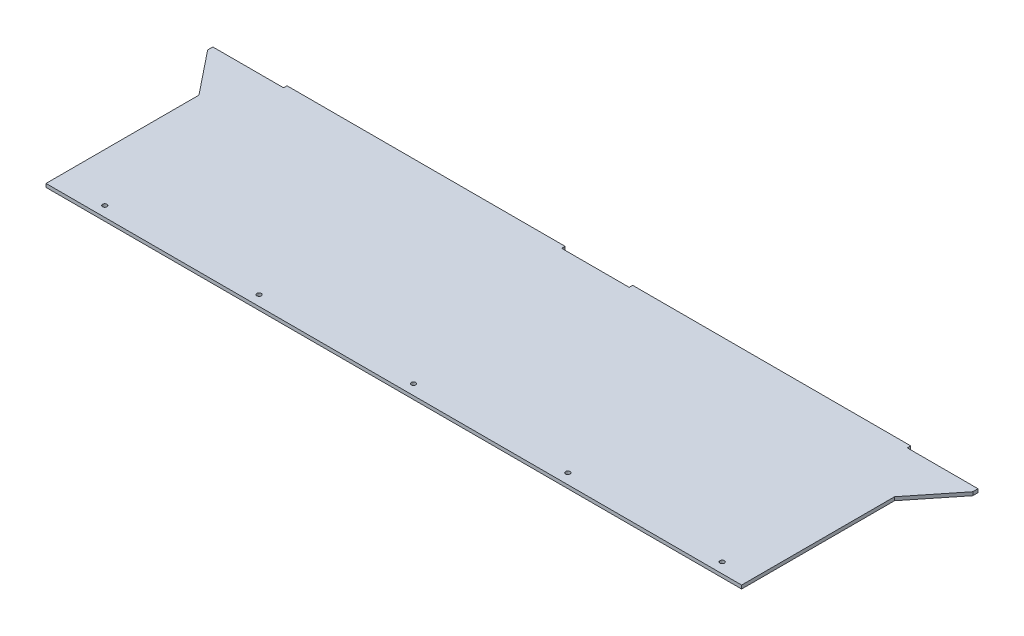
from build123d import *

# Parameters (mm, degrees)
SKETCH1_W           = 635.3556
SKETCH1_H           = 184.15
BOSS_EXTRUDE1_DEPTH = 1.5875
SKETCH2_W           = 254
SKETCH2_H           = 3.175
BOSS_EXTRUDE2_DEPTH = 3.175
BOSS_EXTRUDE3_DEPTH = 3.175
CUT_EXTRUDE1_DEPTH  = 10
LPATTERN1_COUNT     = 5
LPATTERN1_PITCH     = 140.97


with BuildPart() as part:
    # Sketch1 → Boss-Extrude1 (new, symmetric)
    with BuildSketch(Plane(origin=(0, 0, 0), x_dir=(1, 0, 0), z_dir=(0, 1, 0))):
        Rectangle(SKETCH1_W, SKETCH1_H)
    extrude(amount=BOSS_EXTRUDE1_DEPTH, both=True)

    # Sketch2 → Boss-Extrude2 (add)
    with BuildSketch(Plane(origin=(0, 0, -92.075), x_dir=(-1, 0, 0), z_dir=(0, 0, -1))):
        with Locations((-157.8229, 0)):
            Rectangle(SKETCH2_W, SKETCH2_H)
        with Locations((157.8229, 0)):
            Rectangle(SKETCH2_W, SKETCH2_H)
    extrude(amount=BOSS_EXTRUDE2_DEPTH)

    # Sketch3 → Boss-Extrude3 (add)
    with BuildSketch(Plane.XZ.offset(1.5875)):
        Polygon((317.6778, -92.075), (349.4278, -92.075), (349.4278, -87.3125), (317.6778, -47.625), align=None)
    boss_extrude3 = extrude(amount=-BOSS_EXTRUDE3_DEPTH)

    # Mirror1: Boss-Extrude3 across plane
    add(boss_extrude3.mirror(Plane(origin=(0, 0, 0), x_dir=(0, 0, 1), z_dir=(1, 0, 0))))

    # Sketch4 → Cut-Extrude1 (cut)
    with BuildSketch(Plane(origin=(0, 1.5875, 0), x_dir=(1, 0, 0), z_dir=(0, 1, 0))):
        with BuildLine():
            ThreePointArc((292.5248, -82.677), (289.067908768, -81.245108768), (290.4998, -84.702))
            Line((290.4998, -84.702), (290.4998, -82.677))
            Line((290.4998, -82.677), (292.5248, -82.677))
        make_face()
        with BuildLine():
            Line((290.4998, -82.677), (290.4998, -84.702))
            ThreePointArc((290.4998, -84.702), (291.931691232, -84.108891232), (292.5248, -82.677))
            Line((292.5248, -82.677), (290.4998, -82.677))
        make_face()
    cut_extrude1 = extrude(amount=-CUT_EXTRUDE1_DEPTH, mode=Mode.SUBTRACT)

    # LPattern1: Cut-Extrude1 ×5
    with Locations(*[(-i * LPATTERN1_PITCH, 0, 0) for i in range(1, LPATTERN1_COUNT)]):
        add(cut_extrude1, mode=Mode.SUBTRACT)


solid = part.part
